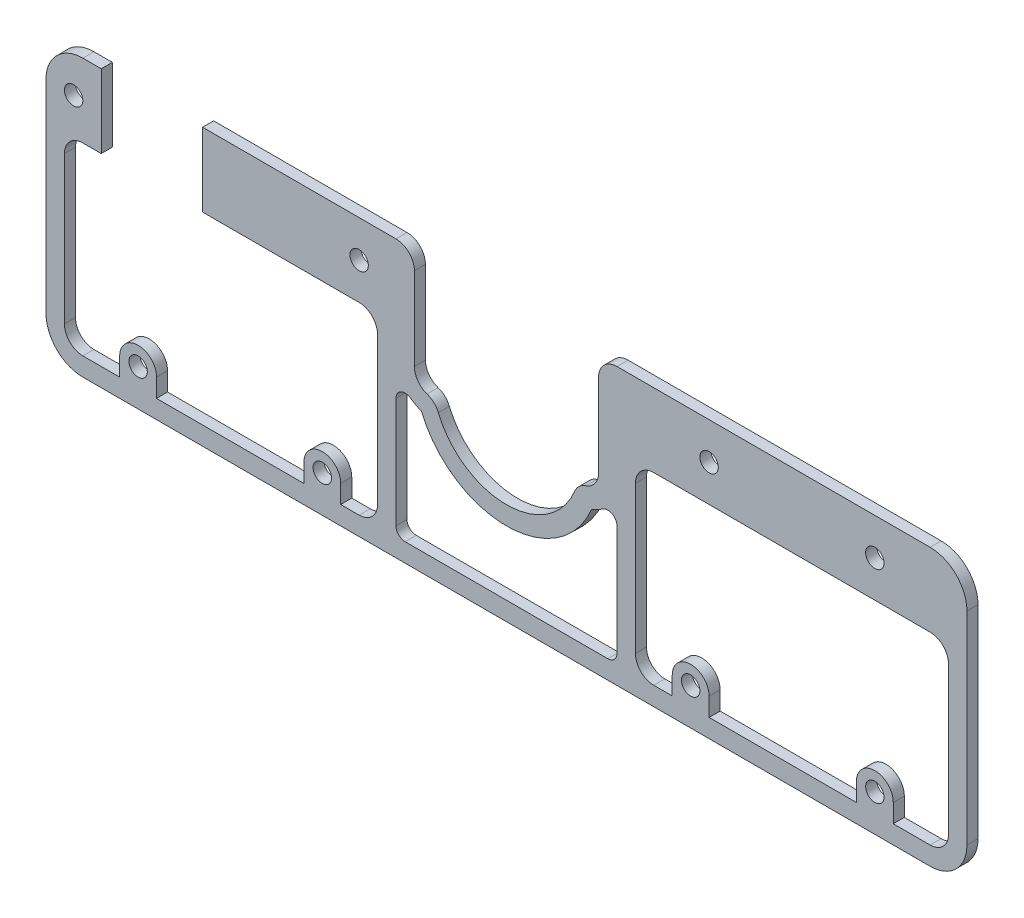
from build123d import *

# Parameters (mm, degrees)
BOSS_EXTRUDE1_DEPTH = 6
SKETCH4_R           = 5
CUT_EXTRUDE2_DEPTH  = 262.076617107
CUT_EXTRUDE5_DEPTH  = 262.076617107
FILLET5_R           = 5
FILLET6_R           = 5
SKETCH9_R           = 5
SKETCH9_W           = 55
SKETCH9_H           = 39.899020921
CUT_EXTRUDE6_DEPTH  = 262.076617107


with BuildPart() as part:
    # Sketch1 → Boss-Extrude1 (new body)
    with BuildSketch(Plane.XY):
        with BuildLine():
            Line((-250, -55), (-250, 3.178280867))
            Line((-250, 3.178280867), (-250, 55))
            ThreePointArc((-250, 55), (-244.142135624, 69.142135624), (-230, 75))
            Line((-230, 75), (-220, 75))
            Line((-220, 75), (-164.330865428, 75))
            Line((-164.330865428, 75), (-60, 75))
            ThreePointArc((-60, 75), (-52.928932188, 72.071067812), (-50, 65))
            Line((-50, 65), (-50, 20))
            ThreePointArc((-50, 20), (-48.100925873, 14.1369803), (-43.125, 10.500822404))
            ThreePointArc((-43.125, 10.500822404), (-39.437786703, 8.32242004), (-37, 4.801315846))
            ThreePointArc((-37, 4.801315846), (-22.271648276, -13.226099426), (0, -20))
            Line((0, -20), (0, -40))
            Line((0, -40), (0, -65))
            Line((0, -65), (0, -75))
            Line((0, -75), (-230, -75))
            ThreePointArc((-230, -75), (-244.142135624, -69.142135624), (-250, -55))
        make_face()
    boss_extrude1 = extrude(amount=BOSS_EXTRUDE1_DEPTH)

    # Mirror1: Boss-Extrude1 across plane
    add(boss_extrude1.mirror(Plane(origin=(0, -20, 6), x_dir=(0, 0, 1), z_dir=(-1, 0, 0))))

    # Sketch4 → Cut-Extrude2 (cut, through all)
    with BuildSketch(Plane.XY.offset(6)):
        with Locations((-200, -55)):
            Circle(SKETCH4_R)
        with Locations((-100, -55)):
            Circle(SKETCH4_R)
        with BuildLine():
            Line((-70, 25.100979079), (-70, -54.899020921))
            ThreePointArc((-70, -54.899020921), (-72.928932188, -61.970088733), (-80, -64.899020921))
            Line((-80, -64.899020921), (-90, -64.899020921))
            Line((-90, -64.899020921), (-90, -55))
            ThreePointArc((-90, -55), (-100, -45), (-110, -55))
            Line((-110, -55), (-110, -65))
            Line((-110, -65), (-190, -65))
            Line((-190, -65), (-190, -55))
            ThreePointArc((-190, -55), (-200, -45), (-210, -55))
            Line((-210, -55), (-210, -65))
            Line((-210, -65), (-230, -65))
            ThreePointArc((-230, -65), (-237.071067812, -62.071067812), (-240, -55))
            Line((-240, -55), (-240, 25.100979079))
            ThreePointArc((-240, 25.100979079), (-237.071067812, 32.17204689), (-230, 35.100979079))
            Line((-230, 35.100979079), (-140, 35.100979079))
            Line((-140, 35.100979079), (-110, 35.100979079))
            Line((-110, 35.100979079), (-80, 35.100979079))
            ThreePointArc((-80, 35.100979079), (-72.928932188, 32.17204689), (-70, 25.100979079))
        make_face()
    cut_extrude2 = extrude(amount=-CUT_EXTRUDE2_DEPTH, mode=Mode.SUBTRACT)

    # Mirror2: Cut-Extrude2 across plane
    add(cut_extrude2.mirror(Plane(origin=(0, 0, 0), x_dir=(0, 0, 1), z_dir=(1, 0, 0))), mode=Mode.SUBTRACT)

    # Sketch8 → Cut-Extrude5 (cut, through all)
    with BuildSketch(Plane.XY.offset(6)):
        with BuildLine():
            Line((-60, 0), (-60, -64.899020921))
            Line((-60, -64.899020921), (60, -64.899020921))
            Line((60, -64.899020921), (60, 0))
            ThreePointArc((60, 0), (57.236067977, 4.472135955), (52, 4))
            ThreePointArc((52, 4), (49.247332505, 2.266223145), (46.25, 1.001644808))
            ThreePointArc((46.25, 1.001644808), (0, -30), (-46.25, 1.001644808))
            ThreePointArc((-46.25, 1.001644808), (-49.247332505, 2.266223145), (-52, 4))
            ThreePointArc((-52, 4), (-57.236067977, 4.472135955), (-60, 0))
        make_face()
    extrude(amount=-CUT_EXTRUDE5_DEPTH, mode=Mode.SUBTRACT)

    # Fillet5
    fillet5_edges = [part.edges().sort_by_distance(p)[0] for p in [
        (-60, -64.899020921, 3),
    ]]
    fillet(fillet5_edges, radius=FILLET5_R)

    # Fillet6
    fillet6_edges = [part.edges().sort_by_distance(p)[0] for p in [
        (60, -64.899020921, 3),
    ]]
    fillet(fillet6_edges, radius=FILLET6_R)

    # Sketch9 → Cut-Extrude6 (cut, through all)
    with BuildSketch(Plane(origin=(0, 0, 0), x_dir=(-1, 0, 0), z_dir=(0, 0, -1))):
        with Locations((-200, 55)):
            Circle(SKETCH9_R)
        with Locations((-110, 55)):
            Circle(SKETCH9_R)
        with Locations((80, 55)):
            Circle(SKETCH9_R)
        with Locations((235, 55)):
            Circle(SKETCH9_R)
        with Locations((192.5, 55.05048954)):
            Rectangle(SKETCH9_W, SKETCH9_H)
    extrude(amount=-CUT_EXTRUDE6_DEPTH, mode=Mode.SUBTRACT)


solid = part.part
